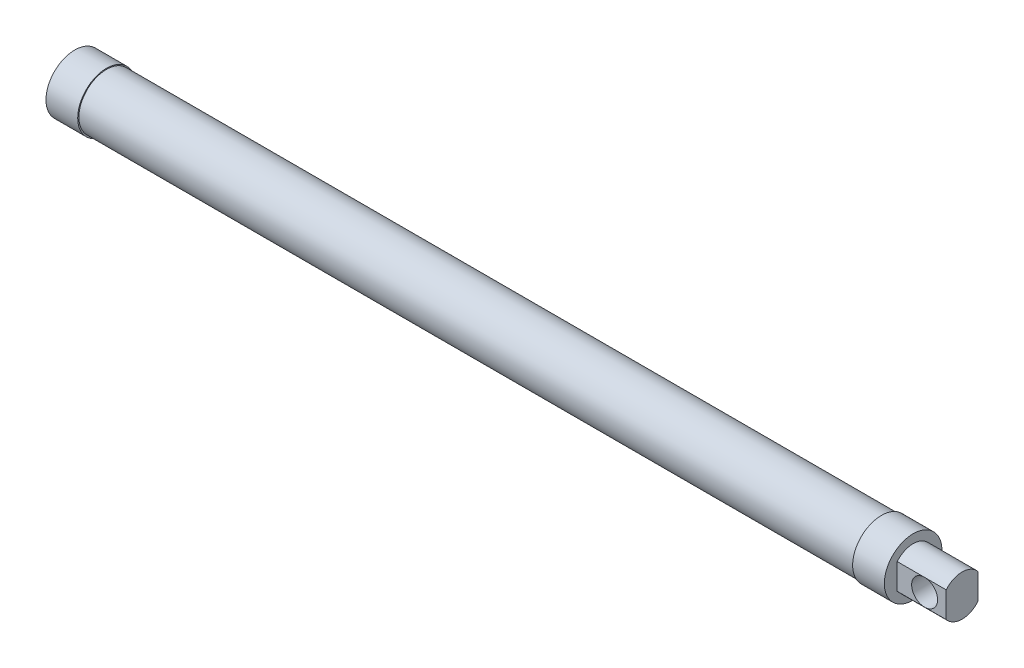
from build123d import *

# Parameters (mm, degrees)
SKETCH1_W               = 280
SKETCH1_H               = 9.58
CUT_EXTRUDE1_DEPTH      = 281.466018322
CUT_EXTRUDE1_DEPTH_BACK = 281.466018322
SKETCH2_R               = 3.05
SKETCH4_R               = 10
BOSS_EXTRUDE1_DEPTH     = 11
CUT_EXTRUDE2_DEPTH      = 281.500482539
CUT_EXTRUDE2_DEPTH_BACK = 281.500482539
SKETCH7_R               = 3.05
SKETCH11_R              = 10
BOSS_EXTRUDE2_DEPTH     = 11
CUT_EXTRUDE4_DEPTH      = 292.481595825
CUT_EXTRUDE4_DEPTH_BACK = 292.481595825
SKETCH12_R              = 3.05
SKETCH13_R              = 7.1
BOSS_EXTRUDE3_DEPTH     = 17
CUT_EXTRUDE5_DEPTH      = 178.977152858
CUT_EXTRUDE5_DEPTH_BACK = 178.977152858
SKETCH14_R              = 4.5
CUT_EXTRUDE6_REACH      = 310.455
SKETCH16_W              = 5.118750851
SKETCH16_H              = 10.923653892
SKETCH16_W_2            = 7.412502438


with BuildPart() as part:
    # Sketch1 → Revolve2 (revolve)
    with BuildSketch(Plane.XY, mode=Mode.PRIVATE) as revolve2_sk:
        with Locations((20.187319621, -1.354200627)):
            Rectangle(SKETCH1_W, SKETCH1_H)
    revolve(revolve2_sk.sketch.rotate(Axis((-119.812680379, 3.435799373, 0), (1, 0, 0)), 270), axis=Axis((-119.812680379, 3.435799373, 0), (1, 0, 0)))

    # Sketch2 → Cut-Extrude1 (cut, two sides: drawn at the far end of the back side and taken through both)
    with BuildSketch(Plane.ZY.offset(119.812680379).offset(-CUT_EXTRUDE1_DEPTH_BACK)):
        with Locations((0, 3.435799373)):
            Circle(SKETCH2_R)
    extrude(amount=CUT_EXTRUDE1_DEPTH + CUT_EXTRUDE1_DEPTH_BACK, mode=Mode.SUBTRACT)

    # Sketch4 → Boss-Extrude1 (add)
    with BuildSketch(Plane(origin=(160.187319621, 0, 0), x_dir=(0, 0, -1), z_dir=(1, 0, 0))):
        with Locations((0, 3.435799373)):
            Circle(SKETCH4_R)
    extrude(amount=-BOSS_EXTRUDE1_DEPTH)

    # Sketch7 → Cut-Extrude2 (cut, two sides: drawn at the far end of the back side and taken through both)
    with BuildSketch(Plane(origin=(160.187319621, 0, 0), x_dir=(0, 0, -1), z_dir=(1, 0, 0)).offset(-CUT_EXTRUDE2_DEPTH_BACK)):
        with Locations((0, 3.360575041)):
            Circle(SKETCH7_R)
    extrude(amount=CUT_EXTRUDE2_DEPTH + CUT_EXTRUDE2_DEPTH_BACK, mode=Mode.SUBTRACT)

    # Sketch11 → Boss-Extrude2 (add)
    with BuildSketch(Plane.ZY.offset(119.812680379)):
        with Locations((0, 3.360575041)):
            Circle(SKETCH11_R)
    extrude(amount=BOSS_EXTRUDE2_DEPTH)

    # Sketch12 → Cut-Extrude4 (cut, two sides: drawn at the far end of the back side and taken through both)
    with BuildSketch(Plane.ZY.offset(130.812680379).offset(-CUT_EXTRUDE4_DEPTH_BACK)):
        with Locations((0, 3.33623901)):
            Circle(SKETCH12_R)
    extrude(amount=CUT_EXTRUDE4_DEPTH + CUT_EXTRUDE4_DEPTH_BACK, mode=Mode.SUBTRACT)

    # Sketch13 → Boss-Extrude3 (add)
    with BuildSketch(Plane(origin=(160.187319621, 0, 0), x_dir=(0, 0, -1), z_dir=(1, 0, 0))):
        with Locations((0, 3.33623901)):
            Circle(SKETCH13_R)
    extrude(amount=BOSS_EXTRUDE3_DEPTH)

    # Sketch14 → Cut-Extrude5 (cut, two sides: drawn at the far end of the back side and taken through both)
    with BuildSketch(Plane.XY.offset(-CUT_EXTRUDE5_DEPTH_BACK)):
        with Locations((169.687319621, 3.33623901)):
            Circle(SKETCH14_R)
    extrude(amount=CUT_EXTRUDE5_DEPTH + CUT_EXTRUDE5_DEPTH_BACK, mode=Mode.SUBTRACT)

    # Cut-Extrude6: up to this face of the body (flat: up to its plane)
    cut_extrude6_end = Plane(part.part.faces().sort_by_distance((160.187319621, 3.435799373, 9.717157288))[0])
    # Sketch16 → Cut-Extrude6 (cut, up to the picked face)
    with BuildSketch(Plane(origin=(177.187319621, 0, 0), x_dir=(0, 0, -1), z_dir=(1, 0, 0)), mode=Mode.PRIVATE) as cut_extrude6_sk1:
        with Locations((-8.074815219, 2.345421333)):
            Rectangle(SKETCH16_W, SKETCH16_H)
    cut_extrude6_tool1 = split(extrude(cut_extrude6_sk1.sketch, amount=-CUT_EXTRUDE6_REACH, mode=Mode.PRIVATE), bisect_by=cut_extrude6_end, keep=Keep.BOTH, mode=Mode.PRIVATE)
    # Sketch16 → Cut-Extrude6 (cut, up to the picked face)
    with BuildSketch(Plane(origin=(177.187319621, 0, 0), x_dir=(0, 0, -1), z_dir=(1, 0, 0)), mode=Mode.PRIVATE) as cut_extrude6_sk2:
        with Locations((9.221691013, 2.345421333)):
            Rectangle(SKETCH16_W_2, SKETCH16_H)
    cut_extrude6_tool2 = split(extrude(cut_extrude6_sk2.sketch, amount=-CUT_EXTRUDE6_REACH, mode=Mode.PRIVATE), bisect_by=cut_extrude6_end, keep=Keep.BOTH, mode=Mode.PRIVATE)
    add(cut_extrude6_tool1.solids().sort_by(Axis((177.18732, 2.345421, 8.074815), (-1, 0, 0)))[0], mode=Mode.SUBTRACT)
    add(cut_extrude6_tool2.solids().sort_by(Axis((177.18732, 2.345421, -9.221691), (-1, 0, 0)))[0], mode=Mode.SUBTRACT)


solid = part.part
